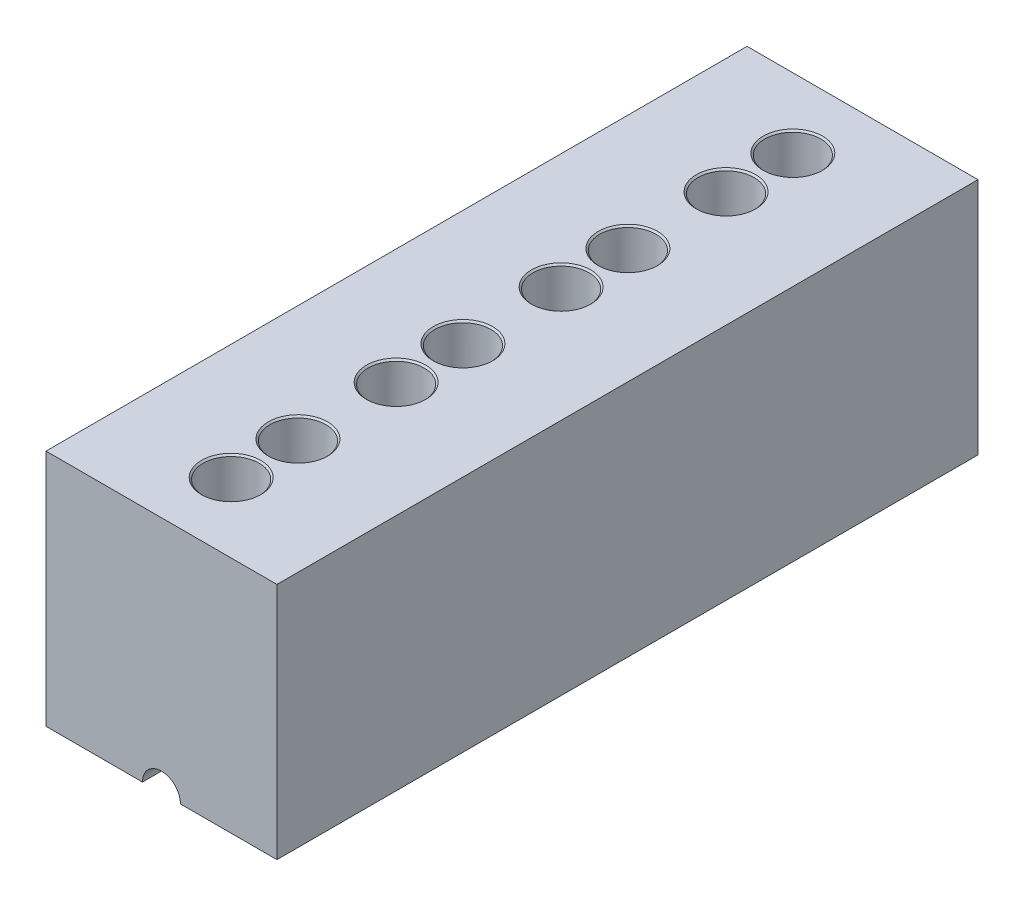
from build123d import *

# Parameters (mm, degrees)
SKETCH1_W            = 140
SKETCH1_H            = 425
BOSS_EXTRUDE1_DEPTH  = 150
SKETCH6_W            = 120
SKETCH6_H            = 405
CUT_EXTRUDE1_DEPTH   = 80
SKETCH7_R            = 3
CUT_EXTRUDE2_DEPTH   = 120
SKETCH9_R            = 17
SKETCH9_R_2          = 3
CUT_EXTRUDE4_DEPTH   = 60
SKETCH9_4_R          = 17
SKETCH9_4_R_2        = 3
CUT_EXTRUDE5_DEPTH   = 30
CHAMFER1_SIZE        = 1
SKETCH12_R           = 13
CUT_EXTRUDE6_DEPTH   = 2
SKETCH13_R           = 20.25
SKETCH13_R_2         = 14
BOSS_EXTRUDE6_DEPTH  = 46.51
SKETCH16_W           = 140
SKETCH16_H           = 425
SKETCH16_W_2         = 120
SKETCH16_H_2         = 405
BOSS_EXTRUDE7_DEPTH  = 48
BOSS_EXTRUDE18_DEPTH = 128
SKETCH22_W           = 120
SKETCH22_H           = 81
CUT_EXTRUDE9_DEPTH   = 81.49
CUT_EXTRUDE10_REACH  = 458.098
SKETCH18_R           = 11.5
CUT_EXTRUDE11_DEPTH  = 53.49
SKETCH24_W           = 120
SKETCH24_H           = 19
CUT_EXTRUDE12_DEPTH  = 53.49
SKETCH25_W           = 40.5
SKETCH25_H           = 22
CUT_EXTRUDE13_DEPTH  = 53.49


with BuildPart() as part:
    # Sketch1 → Boss-Extrude1 (new body)
    with BuildSketch(Plane(origin=(0, 0, 0), x_dir=(1, 0, 0), z_dir=(0, 1, 0))):
        Rectangle(SKETCH1_W, SKETCH1_H)
    extrude(amount=BOSS_EXTRUDE1_DEPTH)

    # Sketch6 → Cut-Extrude1 (cut)
    with BuildSketch(Plane.XZ):
        Rectangle(SKETCH6_W, SKETCH6_H)
    extrude(amount=-CUT_EXTRUDE1_DEPTH, mode=Mode.SUBTRACT)

    # Sketch7 → Cut-Extrude2 (cut)
    with BuildSketch(Plane(origin=(0, 150, 0), x_dir=(1, 0, 0), z_dir=(0, 1, 0))):
        with Locations(Location((0, 170.25, 0), (0, 0, 270))):
            Circle(SKETCH7_R)
        with Locations(Location((0, 129.75, 0), (0, 0, 270))):
            Circle(SKETCH7_R)
        with Locations(Location((0, 70.25, 0), (0, 0, 270))):
            Circle(SKETCH7_R)
        with Locations(Location((0, 29.75, 0), (0, 0, 270))):
            Circle(SKETCH7_R)
        with Locations(Location((0, -29.75, 0), (0, 0, 270))):
            Circle(SKETCH7_R)
        with Locations(Location((0, -70.25, 0), (0, 0, 270))):
            Circle(SKETCH7_R)
        with Locations(Location((0, -129.75, 0), (0, 0, 270))):
            Circle(SKETCH7_R)
        with Locations(Location((0, -170.25, 0), (0, 0, 270))):
            Circle(SKETCH7_R)
    extrude(amount=-CUT_EXTRUDE2_DEPTH, mode=Mode.SUBTRACT)

    # Sketch9 → Cut-Extrude4 (cut)
    # profile 1 of 4: a face of its own
    with BuildSketch(Plane(origin=(0, 150, 0), x_dir=(1, 0, 0), z_dir=(0, 1, 0))):
        with Locations(Location((0, -170.25, 0), (0, 0, 270))):
            Circle(SKETCH9_R)
        with Locations(Location((0, -170.25, 0), (0, 0, 270))):
            Circle(SKETCH9_R_2, mode=Mode.SUBTRACT)
    # profile 2 of 4: a face of its own
    with BuildSketch(Plane(origin=(0, 150, 0), x_dir=(1, 0, 0), z_dir=(0, 1, 0))):
        with Locations(Location((0, -70.25, 0), (0, 0, 270))):
            Circle(SKETCH9_R)
        with Locations(Location((0, -70.25, 0), (0, 0, 270))):
            Circle(SKETCH9_R_2, mode=Mode.SUBTRACT)
    # profile 3 of 4: a face of its own
    with BuildSketch(Plane(origin=(0, 150, 0), x_dir=(1, 0, 0), z_dir=(0, 1, 0))):
        with Locations(Location((0, 29.75, 0), (0, 0, 270))):
            Circle(SKETCH9_R)
        with Locations(Location((0, 29.75, 0), (0, 0, 270))):
            Circle(SKETCH9_R_2, mode=Mode.SUBTRACT)
    # profile 4 of 4: a face of its own
    with BuildSketch(Plane(origin=(0, 150, 0), x_dir=(1, 0, 0), z_dir=(0, 1, 0))):
        with Locations(Location((0, 129.75, 0), (0, 0, 270))):
            Circle(SKETCH9_R)
        with Locations(Location((0, 129.75, 0), (0, 0, 270))):
            Circle(SKETCH9_R_2, mode=Mode.SUBTRACT)
    extrude(amount=-CUT_EXTRUDE4_DEPTH, mode=Mode.SUBTRACT)

    # Sketch9<4> → Cut-Extrude5 (cut)
    # profile 1 of 4: a face of its own
    with BuildSketch(Plane(origin=(0, 150, 0), x_dir=(1, 0, 0), z_dir=(0, 1, 0))):
        with Locations(Location((0, -129.75, 0), (0, 0, 270))):
            Circle(SKETCH9_4_R)
        with Locations(Location((0, -129.75, 0), (0, 0, 270))):
            Circle(SKETCH9_4_R_2, mode=Mode.SUBTRACT)
    # profile 2 of 4: a face of its own
    with BuildSketch(Plane(origin=(0, 150, 0), x_dir=(1, 0, 0), z_dir=(0, 1, 0))):
        with Locations(Location((0, -29.75, 0), (0, 0, 270))):
            Circle(SKETCH9_4_R)
        with Locations(Location((0, -29.75, 0), (0, 0, 270))):
            Circle(SKETCH9_4_R_2, mode=Mode.SUBTRACT)
    # profile 3 of 4: a face of its own
    with BuildSketch(Plane(origin=(0, 150, 0), x_dir=(1, 0, 0), z_dir=(0, 1, 0))):
        with Locations(Location((0, 70.25, 0), (0, 0, 270))):
            Circle(SKETCH9_4_R)
        with Locations(Location((0, 70.25, 0), (0, 0, 270))):
            Circle(SKETCH9_4_R_2, mode=Mode.SUBTRACT)
    # profile 4 of 4: a face of its own
    with BuildSketch(Plane(origin=(0, 150, 0), x_dir=(1, 0, 0), z_dir=(0, 1, 0))):
        with Locations(Location((0, 170.25, 0), (0, 0, 270))):
            Circle(SKETCH9_4_R)
        with Locations(Location((0, 170.25, 0), (0, 0, 270))):
            Circle(SKETCH9_4_R_2, mode=Mode.SUBTRACT)
    extrude(amount=-CUT_EXTRUDE5_DEPTH, mode=Mode.SUBTRACT)

    # Chamfer1
    chamfer1_edges = [part.edges().sort_by_distance(p)[0] for p in [
        (0, 150, 112.75),
        (0, 150, 12.75),
        (0, 150, -87.25),
        (0, 150, -187.25),
        (0, 150, 153.25),
        (0, 150, 53.25),
        (0, 150, -46.75),
        (0, 150, -146.75),
    ]]
    chamfer(chamfer1_edges, length=CHAMFER1_SIZE)

    # Sketch12 → Cut-Extrude6 (cut)
    with BuildSketch(Plane.XZ.offset(-80)):
        with Locations(Location((0, 170.25, 0), (0, 0, 270))):
            Circle(SKETCH12_R)
        with Locations(Location((0, 129.75, 0), (0, 0, 270))):
            Circle(SKETCH12_R)
        with Locations(Location((0, 70.25, 0), (0, 0, 270))):
            Circle(SKETCH12_R)
        with Locations(Location((0, 29.75, 0), (0, 0, 270))):
            Circle(SKETCH12_R)
        with Locations(Location((0, -29.75, 0), (0, 0, 270))):
            Circle(SKETCH12_R)
        with Locations(Location((0, -70.25, 0), (0, 0, 270))):
            Circle(SKETCH12_R)
        with Locations(Location((0, -129.75, 0), (0, 0, 270))):
            Circle(SKETCH12_R)
        with Locations(Location((0, -170.25, 0), (0, 0, 270))):
            Circle(SKETCH12_R)
    extrude(amount=-CUT_EXTRUDE6_DEPTH, mode=Mode.SUBTRACT)

    # Sketch13 → Boss-Extrude6 (add)
    # profile 1 of 16: a face of its own
    with BuildSketch(Plane.XZ.offset(-80)):
        with Locations((0, 129.75)):
            Circle(SKETCH13_R)
        with Locations(Location((0, 129.75, 0), (0, 0, 270))):
            Circle(SKETCH13_R_2, mode=Mode.SUBTRACT)
    # profile 2 of 16: a face of its own
    with BuildSketch(Plane.XZ.offset(-80)):
        with BuildLine():
            ThreePointArc((5.52e-07, 150), (-14.318912124, 155.931087486), (-20.25, 170.25))
            Line((-20.25, 170.25), (-20.25, 129.75))
            ThreePointArc((-20.25, 129.75), (-14.318912124, 144.068912514), (5.52e-07, 150))
        make_face()
    # profile 3 of 16: a face of its own
    with BuildSketch(Plane.XZ.offset(-80)):
        with Locations((0, 170.25)):
            Circle(SKETCH13_R)
        with Locations(Location((0, 170.25, 0), (0, 0, 270))):
            Circle(SKETCH13_R_2, mode=Mode.SUBTRACT)
    # profile 4 of 16: a face of its own
    with BuildSketch(Plane.XZ.offset(-80)):
        with BuildLine():
            Line((20.25, 129.75), (20.25, 170.25))
            ThreePointArc((20.25, 170.25), (14.318912514, 155.931087876), (5.52e-07, 150))
            ThreePointArc((5.52e-07, 150), (14.318912514, 144.068912124), (20.25, 129.75))
        make_face()
    # profile 5 of 16: a face of its own
    with BuildSketch(Plane.XZ.offset(-80)):
        with BuildLine():
            ThreePointArc((-7.7e-08, 50), (-14.318912346, 55.931087708), (-20.25, 70.25))
            Line((-20.25, 70.25), (-20.25, 29.75))
            ThreePointArc((-20.25, 29.75), (-14.318912346, 44.068912292), (-7.7e-08, 50))
        make_face()
    # profile 6 of 16: a face of its own
    with BuildSketch(Plane.XZ.offset(-80)):
        with Locations((0, 29.75)):
            Circle(SKETCH13_R)
        with Locations(Location((0, 29.75, 0), (0, 0, 270))):
            Circle(SKETCH13_R_2, mode=Mode.SUBTRACT)
    # profile 7 of 16: a face of its own
    with BuildSketch(Plane.XZ.offset(-80)):
        with BuildLine():
            Line((20.25, 29.75), (20.25, 70.25))
            ThreePointArc((20.25, 70.25), (14.318912292, 55.931087654), (-7.7e-08, 50))
            ThreePointArc((-7.7e-08, 50), (14.318912292, 44.068912346), (20.25, 29.75))
        make_face()
    # profile 8 of 16: a face of its own
    with BuildSketch(Plane.XZ.offset(-80)):
        with Locations((0, 70.25)):
            Circle(SKETCH13_R)
        with Locations(Location((0, 70.25, 0), (0, 0, 270))):
            Circle(SKETCH13_R_2, mode=Mode.SUBTRACT)
    # profile 9 of 16: a face of its own
    with BuildSketch(Plane.XZ.offset(-80)):
        with BuildLine():
            ThreePointArc((2.8e-07, -50), (-14.31891222, -44.068912418), (-20.25, -29.75))
            Line((-20.25, -29.75), (-20.25, -70.25))
            ThreePointArc((-20.25, -70.25), (-14.31891222, -55.931087582), (2.8e-07, -50))
        make_face()
    # profile 10 of 16: a face of its own
    with BuildSketch(Plane.XZ.offset(-80)):
        with BuildLine():
            Line((20.25, -70.25), (20.25, -29.75))
            ThreePointArc((20.25, -29.75), (14.318912418, -44.06891222), (2.8e-07, -50))
            ThreePointArc((2.8e-07, -50), (14.318912418, -55.93108778), (20.25, -70.25))
        make_face()
    # profile 11 of 16: a face of its own
    with BuildSketch(Plane.XZ.offset(-80)):
        with Locations((0, -29.75)):
            Circle(SKETCH13_R)
        with Locations(Location((0, -29.75, 0), (0, 0, 270))):
            Circle(SKETCH13_R_2, mode=Mode.SUBTRACT)
    # profile 12 of 16: a face of its own
    with BuildSketch(Plane.XZ.offset(-80)):
        with Locations((0, -70.25)):
            Circle(SKETCH13_R)
        with Locations(Location((0, -70.25, 0), (0, 0, 270))):
            Circle(SKETCH13_R_2, mode=Mode.SUBTRACT)
    # profile 13 of 16: a face of its own
    with BuildSketch(Plane.XZ.offset(-80)):
        with BuildLine():
            ThreePointArc((1.2e-07, -150), (-14.318912276, -144.068912362), (-20.25, -129.75))
            Line((-20.25, -129.75), (-20.25, -170.25))
            ThreePointArc((-20.25, -170.25), (-14.318912276, -155.931087638), (1.2e-07, -150))
        make_face()
    # profile 14 of 16: a face of its own
    with BuildSketch(Plane.XZ.offset(-80)):
        with BuildLine():
            Line((20.25, -170.25), (20.25, -129.75))
            ThreePointArc((20.25, -129.75), (14.318912362, -144.068912276), (1.2e-07, -150))
            ThreePointArc((1.2e-07, -150), (14.318912362, -155.931087724), (20.25, -170.25))
        make_face()
    # profile 15 of 16: a face of its own
    with BuildSketch(Plane.XZ.offset(-80)):
        with Locations((0, -129.75)):
            Circle(SKETCH13_R)
        with Locations(Location((0, -129.75, 0), (0, 0, 270))):
            Circle(SKETCH13_R_2, mode=Mode.SUBTRACT)
    # profile 16 of 16: a face of its own
    with BuildSketch(Plane.XZ.offset(-80)):
        with Locations((0, -170.25)):
            Circle(SKETCH13_R)
        with Locations(Location((0, -170.25, 0), (0, 0, 270))):
            Circle(SKETCH13_R_2, mode=Mode.SUBTRACT)
    extrude(amount=BOSS_EXTRUDE6_DEPTH)

    # Sketch16 → Boss-Extrude7 (add)
    with BuildSketch(Plane.XZ):
        Rectangle(SKETCH16_W, SKETCH16_H)
        Rectangle(SKETCH16_W_2, SKETCH16_H_2, mode=Mode.SUBTRACT)
    extrude(amount=BOSS_EXTRUDE7_DEPTH)

    # Sketch19 → Boss-Extrude18 (add)
    with BuildSketch(Plane.XZ.offset(-80)):
        with BuildLine():
            Line((-60, 109.5), (-60, 90.5))
            Line((-60, 90.5), (-20.25, 90.5))
            Line((-20.25, 90.5), (-20.25, 70.25))
            ThreePointArc((-20.25, 70.25), (0, 90.5), (20.25, 70.25))
            Line((20.25, 70.25), (20.25, 90.5))
            Line((20.25, 90.5), (60, 90.5))
            Line((60, 90.5), (60, 109.5))
            Line((60, 109.5), (20.25, 109.5))
            Line((20.25, 109.5), (20.25, 129.75))
            ThreePointArc((20.25, 129.75), (0, 109.5), (-20.25, 129.75))
            Line((-20.25, 129.75), (-20.25, 109.5))
            Line((-20.25, 109.5), (-60, 109.5))
        make_face()
        with BuildLine():
            Line((-20.25, 9.5), (-60, 9.5))
            Line((-60, 9.5), (-60, -9.5))
            Line((-60, -9.5), (-20.25, -9.5))
            Line((-20.25, -9.5), (-20.25, -29.75))
            ThreePointArc((-20.25, -29.75), (0, -9.5), (20.25, -29.75))
            Line((20.25, -29.75), (20.25, -9.5))
            Line((20.25, -9.5), (60, -9.5))
            Line((60, -9.5), (60, 9.5))
            Line((60, 9.5), (20.25, 9.5))
            Line((20.25, 9.5), (20.25, 29.75))
            ThreePointArc((20.25, 29.75), (0, 9.5), (-20.25, 29.75))
            Line((-20.25, 29.75), (-20.25, 9.5))
        make_face()
        with BuildLine():
            Line((-60, 202.5), (-60, 190.5))
            Line((-60, 190.5), (-20.25, 190.5))
            Line((-20.25, 190.5), (-20.25, 170.25))
            ThreePointArc((-20.25, 170.25), (0, 190.5), (20.25, 170.25))
            Line((20.25, 170.25), (20.25, 190.5))
            Line((20.25, 190.5), (60, 190.5))
            Line((60, 190.5), (60, 202.5))
            Line((60, 202.5), (-60, 202.5))
        make_face()
        with BuildLine():
            Line((-20.25, -90.5), (-60, -90.5))
            Line((-60, -90.5), (-60, -109.5))
            Line((-60, -109.5), (-20.25, -109.5))
            Line((-20.25, -109.5), (-20.25, -129.75))
            ThreePointArc((-20.25, -129.75), (0, -109.5), (20.25, -129.75))
            Line((20.25, -129.75), (20.25, -109.5))
            Line((20.25, -109.5), (60, -109.5))
            Line((60, -109.5), (60, -90.5))
            Line((60, -90.5), (20.25, -90.5))
            Line((20.25, -90.5), (20.25, -70.25))
            ThreePointArc((20.25, -70.25), (0, -90.5), (-20.25, -70.25))
            Line((-20.25, -70.25), (-20.25, -90.5))
        make_face()
        with BuildLine():
            Line((-60, -190.5), (-60, -202.5))
            Line((-60, -202.5), (60, -202.5))
            Line((60, -202.5), (60, -190.5))
            Line((60, -190.5), (20.25, -190.5))
            Line((20.25, -190.5), (20.25, -170.25))
            ThreePointArc((20.25, -170.25), (0, -190.5), (-20.25, -170.25))
            Line((-20.25, -170.25), (-20.25, -190.5))
            Line((-20.25, -190.5), (-60, -190.5))
        make_face()
    extrude(amount=BOSS_EXTRUDE18_DEPTH)

    # Sketch22 → Cut-Extrude9 (cut)
    with BuildSketch(Plane.XZ.offset(48)):
        with Locations((0, 150)):
            Rectangle(SKETCH22_W, SKETCH22_H)
        with Locations((0, 50)):
            Rectangle(SKETCH22_W, SKETCH22_H)
        with Locations((0, -50)):
            Rectangle(SKETCH22_W, SKETCH22_H)
        with Locations((0, -150)):
            Rectangle(SKETCH22_W, SKETCH22_H)
    extrude(amount=-CUT_EXTRUDE9_DEPTH, mode=Mode.SUBTRACT)

    # Cut-Extrude10: up to this face of the body (flat: up to its plane)
    cut_extrude10_end = Plane(part.part.faces().sort_by_distance((0, 51, -212.5))[0])
    # Sketch18 → Cut-Extrude10 (cut, up to the picked face)
    with BuildSketch(Plane.XY.offset(212.5), mode=Mode.PRIVATE) as cut_extrude10_sk1:
        with Locations((0, 5.49)):
            Circle(SKETCH18_R)
    cut_extrude10_tool1 = split(extrude(cut_extrude10_sk1.sketch, amount=-CUT_EXTRUDE10_REACH, mode=Mode.PRIVATE), bisect_by=cut_extrude10_end, keep=Keep.BOTH, mode=Mode.PRIVATE)
    add(cut_extrude10_tool1.solids().sort_by(Axis((0, 5.49, 212.5), (0, 0, -1)))[0], mode=Mode.SUBTRACT)

    # Sketch23 → Cut-Extrude11 (cut)
    with BuildSketch(Plane.XZ.offset(48)):
        Polygon((-70, 212.5), (-70, 190.5), (-60, 190.5), (-20.25, 190.5), (-20.25, 212.5), align=None)
        Polygon((-70, 190.5), (-70, -190.5), (-60, -190.5), (-60, -109.5), (-60, -90.5), (-60, -9.5), (-60, 9.5), (-60, 90.5), (-60, 109.5), (-60, 190.5), align=None)
        Polygon((60, 190.5), (70, 190.5), (70, 212.5), (20.25, 212.5), (20.25, 190.5), align=None)
        Polygon((60, -190.5), (70, -190.5), (70, 190.5), (60, 190.5), (60, 109.5), (60, 90.5), (60, 9.5), (60, -9.5), (60, -90.5), (60, -109.5), align=None)
        Polygon((-70, -190.5), (-70, -212.5), (-20.25, -212.5), (-20.25, -190.5), (-60, -190.5), align=None)
        Polygon((20.25, -190.5), (20.25, -212.5), (70, -212.5), (70, -190.5), (60, -190.5), align=None)
    extrude(amount=-CUT_EXTRUDE11_DEPTH, mode=Mode.SUBTRACT)

    # Sketch24 → Cut-Extrude12 (cut)
    with BuildSketch(Plane.XZ.offset(48)):
        with Locations((0, -100)):
            Rectangle(SKETCH24_W, SKETCH24_H)
        Rectangle(SKETCH24_W, SKETCH24_H)
        with Locations((0, 100)):
            Rectangle(SKETCH24_W, SKETCH24_H)
    extrude(amount=-CUT_EXTRUDE12_DEPTH, mode=Mode.SUBTRACT)

    # Sketch25 → Cut-Extrude13 (cut)
    with BuildSketch(Plane.XZ.offset(48)):
        with Locations((0, -201.5)):
            Rectangle(SKETCH25_W, SKETCH25_H)
        with Locations((0, 201.5)):
            Rectangle(SKETCH25_W, SKETCH25_H)
    extrude(amount=-CUT_EXTRUDE13_DEPTH, mode=Mode.SUBTRACT)


solid = part.part
